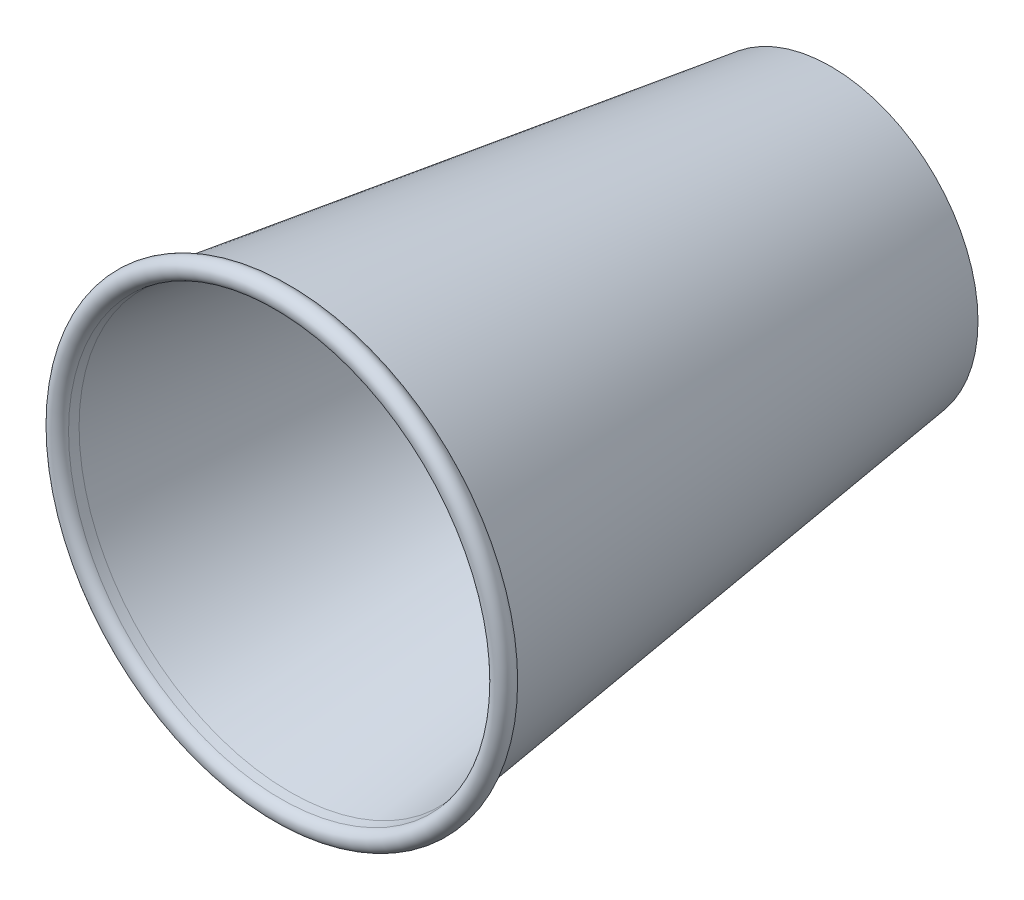
from build123d import *

# Parameters (mm, degrees)
SKETCH2_R = 1.980736
FILLET2_R = 100


with BuildPart() as part:
    # Sketch1 → Cup (revolve)
    with BuildSketch(Plane(origin=(0, 0, 0), x_dir=(-1, 0, 0), z_dir=(0, 1, 0)), mode=Mode.PRIVATE) as cup_sk:
        Polygon((0, 3), (-27.6, 3), (-27.6, 0), (-29.573, 0), (-44.616104, 110.4), (-42.635368, 110.4), (-28.23035, 5), (0, 5), align=None)
    revolve(cup_sk.sketch.rotate(Axis((0, 0, -50), (0, 0, 1)), 180), axis=Axis((0, 0, -50), (0, 0, 1)))

    # Sketch2 → BeadRound (revolve)
    with BuildSketch(Plane(origin=(0, 0, 0), x_dir=(-1, 0, 0), z_dir=(0, 1, 0))):
        with Locations((-44.616104, 110.4)):
            Circle(SKETCH2_R)
    revolve(axis=Axis((0, 0, -50), (0, 0, 1)))

    # Fillet2
    fillet2_edges = [part.edges().sort_by_distance(p)[0] for p in [
        (0, -42.635368, 110.4),
    ]]
    fillet(fillet2_edges, radius=FILLET2_R)


solid = part.part
